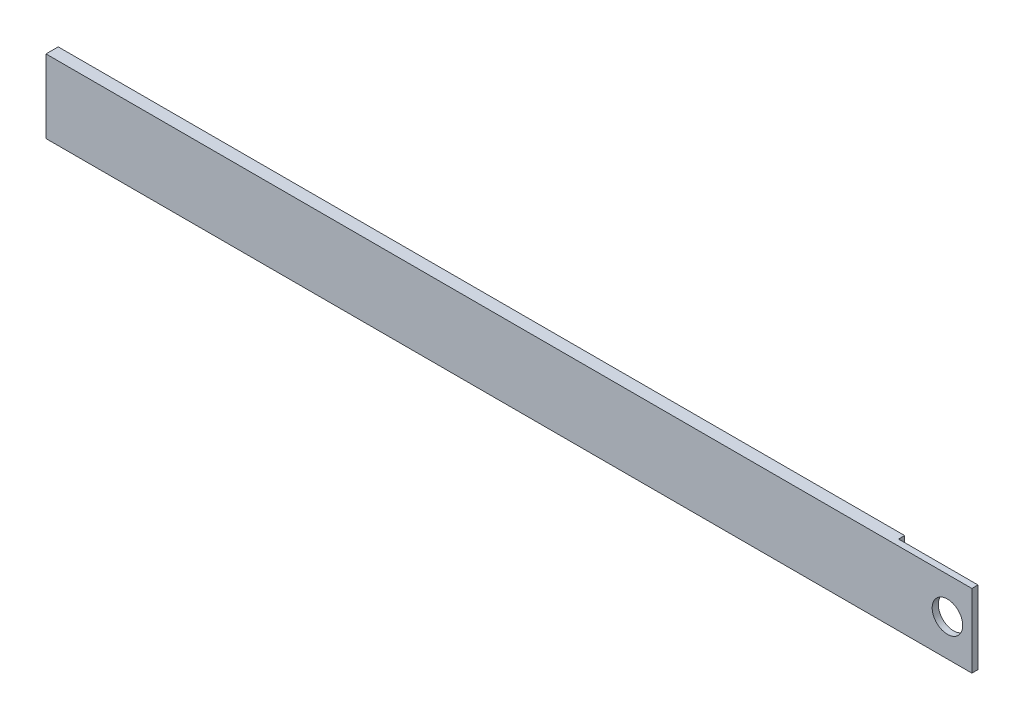
from build123d import *

# Parameters (mm, degrees)
SALIENTE_EXTRUIR1_DEPTH = 12
CROQUIS4_R              = 2.5
CORTAR_EXTRUIR1_DEPTH   = 1
CROQUIS5_R              = 1.5
CORTAR_EXTRUIR2_DEPTH   = 1
CROQUIS6_W              = 13
CROQUIS6_H              = 1
CORTAR_EXTRUIR3_DEPTH   = 12


with BuildPart() as part:
    # Croquis1 → Saliente-Extruir1 (new body)
    with BuildSketch(Plane(origin=(0, 0, 0), x_dir=(1, 0, 0), z_dir=(0, 1, 0))):
        Polygon((-65.844332906, 24.038216561), (83.155667094, 24.038216561), (83.155667094, 26.038216561), (-65.844332906, 26.038216561), (-68.344332906, 26.038216561), (-68.344332906, 24.038216561), align=None)
    extrude(amount=SALIENTE_EXTRUIR1_DEPTH)

    # Croquis4 → Cortar-Extruir1 (cut)
    with BuildSketch(Plane.XY.offset(-24.038216561)):
        with Locations((79.155667094, 6)):
            Circle(CROQUIS4_R)
    extrude(amount=-CORTAR_EXTRUIR1_DEPTH, mode=Mode.SUBTRACT)

    # Croquis5 → Cortar-Extruir2 (cut)
    with BuildSketch(Plane.XY.offset(-25.038216561)):
        with Locations((79.155667094, 6)):
            Circle(CROQUIS5_R)
    extrude(amount=-CORTAR_EXTRUIR2_DEPTH, mode=Mode.SUBTRACT)

    # Croquis6 → Cortar-Extruir3 (cut)
    with BuildSketch(Plane(origin=(0, 12, 0), x_dir=(1, 0, 0), z_dir=(0, 1, 0))):
        with Locations((76.655667094, 25.538216561)):
            Rectangle(CROQUIS6_W, CROQUIS6_H)
    extrude(amount=-CORTAR_EXTRUIR3_DEPTH, mode=Mode.SUBTRACT)


solid = part.part
